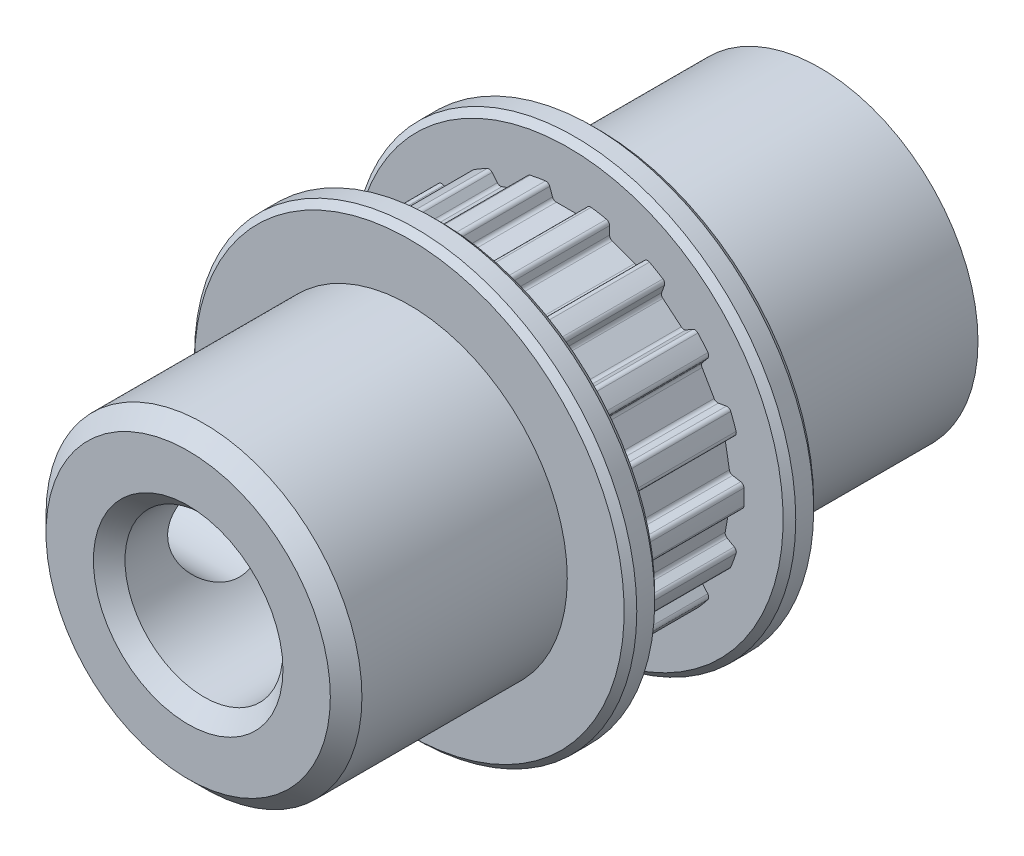
from build123d import *

# Parameters (mm, degrees)
TOOTH_EXTRUDE_START    = -2.032
TOOTH_EXTRUDE_DEPTH    = 4.064
TOOTH_PATTERN_18_COUNT = 18
SKETCH4_R              = 5
EXTRUDE_770_DEPTH      = 7
SKETCH6_R              = 1.65
CUT_EXTRUDE_924_DEPTH  = 5
BOSS_EXTRUDE3_START    = 8
SKETCH8_R              = 5
BOSS_EXTRUDE3_DEPTH    = 8
SKETCH5_R              = 2.5
CUT_EXTRUDE4_DEPTH     = 23
CHAMFER1_SIZE          = 0.5
CHAMFER2_SIZE          = 0.2
CHAMFER3_SIZE          = 1
CHAMFER3_SIZE2         = 1.732050808


with BuildPart() as part:
    # GearBelt-BaseSketch → 0.080in Pitch 'MXL', 0.125in Belt Width, 11,6425mm P.D. (revolve)
    with BuildSketch(Plane(origin=(0, 0, 0), x_dir=(0, 0, -1), z_dir=(1, 0, 0)), mode=Mode.PRIVATE) as f_0_080in_pitch_mxl_0_125in_belt_width_sk:
        Polygon((-3, 0), (3, 0), (3, 7), (2.032, 7), (2.032, 5.567251199), (-2.032, 5.567251199), (-2.032, 7), (-3, 7), align=None)
    revolve(f_0_080in_pitch_mxl_0_125in_belt_width_sk.sketch.rotate(Axis((0, 0, 3.048), (0, 0, -1)), 90), axis=Axis((0, 0, 3.048), (0, 0, -1)))

    # Tooth-Sketch → Tooth-Extrude (cut)
    with BuildSketch(Plane.XY.offset(TOOTH_EXTRUDE_START)):
        with BuildLine():
            Line((-0.379703626, 5.110051208), (0.379703626, 5.110051208))
            ThreePointArc((0.379703626, 5.110051208), (0.452547836, 5.133018899), (0.499044593, 5.193614652))
            Line((0.499044593, 5.193614652), (0.587822803, 5.43753078))
            ThreePointArc((0.587822803, 5.43753078), (0.641250062, 5.502650124), (0.723672162, 5.520016713))
            Line((0.723672162, 5.520016713), (0.723672162, 8.060016713))
            Line((0.723672162, 8.060016713), (-0.723672162, 8.060016713))
            Line((-0.723672162, 8.060016713), (-0.723672162, 5.520016713))
            ThreePointArc((-0.723672162, 5.520016713), (-0.641250062, 5.502650124), (-0.587822803, 5.43753078))
            Line((-0.587822803, 5.43753078), (-0.499044593, 5.193614652))
            ThreePointArc((-0.499044593, 5.193614652), (-0.452547836, 5.133018899), (-0.379703626, 5.110051208))
        make_face()
    tooth_extrude = extrude(amount=TOOTH_EXTRUDE_DEPTH, mode=Mode.SUBTRACT)

    # Tooth Pattern, 18: Tooth-Extrude ×18 about axis
    tooth_pattern_18_axis = Axis((0, 0, 0), (0, 0, 1))
    for i in range(1, TOOTH_PATTERN_18_COUNT):
        add(tooth_extrude.rotate(tooth_pattern_18_axis, i * 360 / TOOTH_PATTERN_18_COUNT), mode=Mode.SUBTRACT)

    # Sketch4 → Extrude 770 (add)
    with BuildSketch(Plane.XY.offset(3)):
        with Locations(Location((0, 0, 0), (0, 0, 180))):
            Circle(SKETCH4_R)
    extrude(amount=EXTRUDE_770_DEPTH)

    # Sketch6 → Cut-Extrude 924 (cut)
    with BuildSketch(Plane.ZY.offset(5)):
        with Locations((6.5, 0)):
            Circle(SKETCH6_R)
    extrude(amount=-CUT_EXTRUDE_924_DEPTH, mode=Mode.SUBTRACT)

    # Sketch8 → Boss-Extrude3 (add)
    with BuildSketch(Plane(origin=(0, 0, -3), x_dir=(-1, 0, 0), z_dir=(0, 0, -1)).offset(BOSS_EXTRUDE3_START)):
        Circle(SKETCH8_R)
    extrude(amount=-BOSS_EXTRUDE3_DEPTH)

    # Sketch5 → Cut-Extrude4 (cut)
    with BuildSketch(Plane.XY.offset(10)):
        Circle(SKETCH5_R)
    extrude(amount=-CUT_EXTRUDE4_DEPTH, mode=Mode.SUBTRACT)

    # Chamfer1
    chamfer1_edges = [part.edges().sort_by_distance(p)[0] for p in [
        (5, 0, 10),
        (-2.5, 0, 10),
    ]]
    chamfer(chamfer1_edges, length=CHAMFER1_SIZE)

    # Chamfer2
    chamfer2_edges = [part.edges().sort_by_distance(p)[0] for p in [
        (-7, 0, -3),
        (-7, 0, -2.032),
        (-7, 0, 2.032),
        (-7, 0, 3),
    ]]
    chamfer(chamfer2_edges, length=CHAMFER2_SIZE)

    # Chamfer3
    chamfer3_edges = [part.edges().sort_by_distance(p)[0] for p in [
        (5, 0, -11),
    ]]
    chamfer3_side = [part.faces().sort_by_distance(p)[0] for p in [
        (5, 0, -7),
    ]]
    chamfer(chamfer3_edges, length=CHAMFER3_SIZE, length2=CHAMFER3_SIZE2, reference=chamfer3_side[0])


solid = part.part
